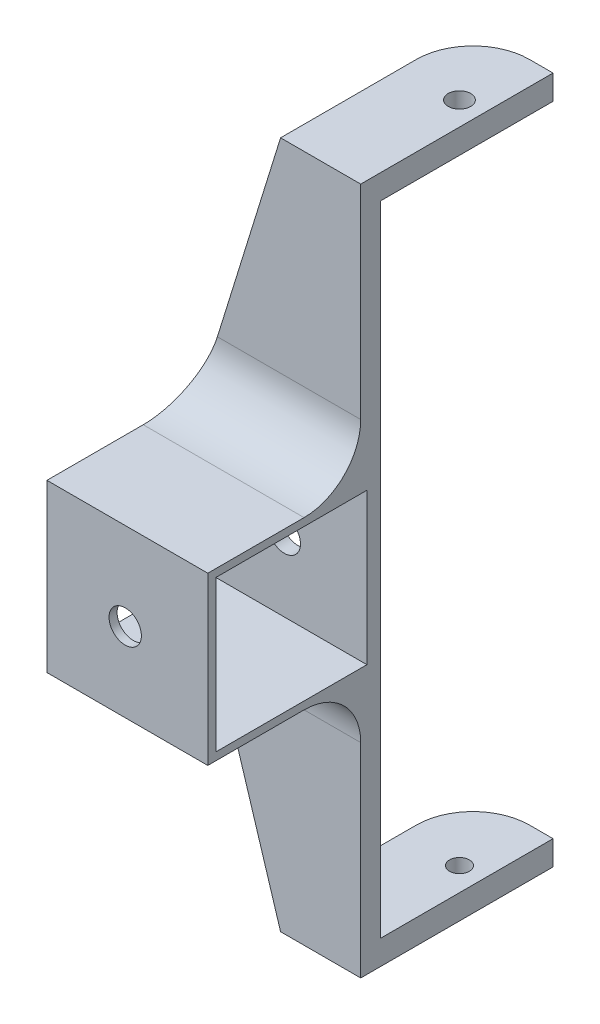
from build123d import *

# Parameters (mm, degrees)
SKETCH2_W           = 28.40399364
SKETCH2_H           = 29.4
BOSS_EXTRUDE1_DEPTH = 30.48
BOSS_EXTRUDE2_DEPTH = 3.48
SKETCH7_W           = 14.151447967
SKETCH7_H           = 4.326095682
BOSS_EXTRUDE3_DEPTH = 30.48
SKETCH8_R           = 1.986850399
CUT_EXTRUDE3_DEPTH  = 4.48
FILLET2_R           = 10
SKETCH4_R           = 2.85648699
CUT_EXTRUDE2_DEPTH  = 30.48
FILLET3_R           = 10
SKETCH9_R           = 1.75
CUT_EXTRUDE4_DEPTH  = 4.48
SKETCH3_W           = 26.67
SKETCH3_H           = 26.67
CUT_EXTRUDE1_DEPTH  = 30.48
FILLET4_R           = 10


with BuildPart() as part:
    # Sketch2 → Boss-Extrude1 (new body)
    with BuildSketch(Plane.XY):
        with Locations((48.284161423, 4.792820272)):
            Rectangle(SKETCH2_W, SKETCH2_H)
    boss_extrude1 = extrude(amount=BOSS_EXTRUDE1_DEPTH)

    # Sketch5 → Boss-Extrude2 (add)
    with BuildSketch(Plane(origin=(0, 0, 0), x_dir=(-1, 0, 0), z_dir=(0, 0, -1))):
        Polygon((-62.486158243, 19.492820272), (-62.486158243, 65.492820272), (-48.334710276, 65.492820272), (-34.082164603, 19.492820272), align=None)
    boss_extrude2 = extrude(amount=-BOSS_EXTRUDE2_DEPTH)

    # Sketch7 → Boss-Extrude3 (add)
    with BuildSketch(Plane(origin=(0, 0, 0), x_dir=(-1, 0, 0), z_dir=(0, 0, -1))):
        with Locations((-55.41043426, 63.329772431)):
            Rectangle(SKETCH7_W, SKETCH7_H)
    boss_extrude3 = extrude(amount=BOSS_EXTRUDE3_DEPTH)

    # Sketch8 → Cut-Extrude3 (cut)
    with BuildSketch(Plane(origin=(0, 65.492820272, 0), x_dir=(1, 0, 0), z_dir=(0, 1, 0))):
        with Locations((58.338019211, 18.1)):
            Circle(SKETCH8_R)
    extrude(amount=-CUT_EXTRUDE3_DEPTH, mode=Mode.SUBTRACT)

    # Fillet2
    fillet2_edges = [part.edges().sort_by_distance(p)[0] for p in [
        (48.284161423, 19.492820272, 3.48),
    ]]
    fillet(fillet2_edges, radius=FILLET2_R)

    # Mirror3: Boss-Extrude1, Boss-Extrude2, Boss-Extrude3 across plane
    add(boss_extrude1.mirror(Plane(origin=(0, 4.792820272, 0), x_dir=(0, 0, 1), z_dir=(0, -1, 0))))
    add(boss_extrude2.mirror(Plane(origin=(0, 4.792820272, 0), x_dir=(0, 0, 1), z_dir=(0, -1, 0))))
    add(boss_extrude3.mirror(Plane(origin=(0, 4.792820272, 0), x_dir=(0, 0, 1), z_dir=(0, -1, 0))))

    # Sketch4 → Cut-Extrude2 (cut)
    with BuildSketch(Plane.XY.offset(30.48)):
        with Locations((47.902483521, 4.05454278)):
            Circle(SKETCH4_R)
    extrude(amount=-CUT_EXTRUDE2_DEPTH, mode=Mode.SUBTRACT)

    # Fillet3
    fillet3_edges = [part.edges().sort_by_distance(p)[0] for p in [
        (48.284161423, -9.907179728, 3.48),
    ]]
    fillet(fillet3_edges, radius=FILLET3_R)

    # Sketch9 → Cut-Extrude4 (cut)
    with BuildSketch(Plane.XZ.offset(55.907179728)):
        with Locations((58.338019211, -18.1)):
            Circle(SKETCH9_R)
    extrude(amount=-CUT_EXTRUDE4_DEPTH, mode=Mode.SUBTRACT)

    # Sketch3 → Cut-Extrude1 (cut)
    with BuildSketch(Plane(origin=(62.486158243, 0, 0), x_dir=(0, 0, -1), z_dir=(1, 0, 0))):
        with Locations((-15.72499675, 4.792820272)):
            Rectangle(SKETCH3_W, SKETCH3_H)
    extrude(amount=-CUT_EXTRUDE1_DEPTH, mode=Mode.SUBTRACT)

    # Fillet4
    fillet4_edges = [part.edges().sort_by_distance(p)[0] for p in [
        (48.334710276, 63.329772431, -30.48),
        (48.334710276, -53.744131887, -30.48),
    ]]
    fillet(fillet4_edges, radius=FILLET4_R)


solid = part.part
